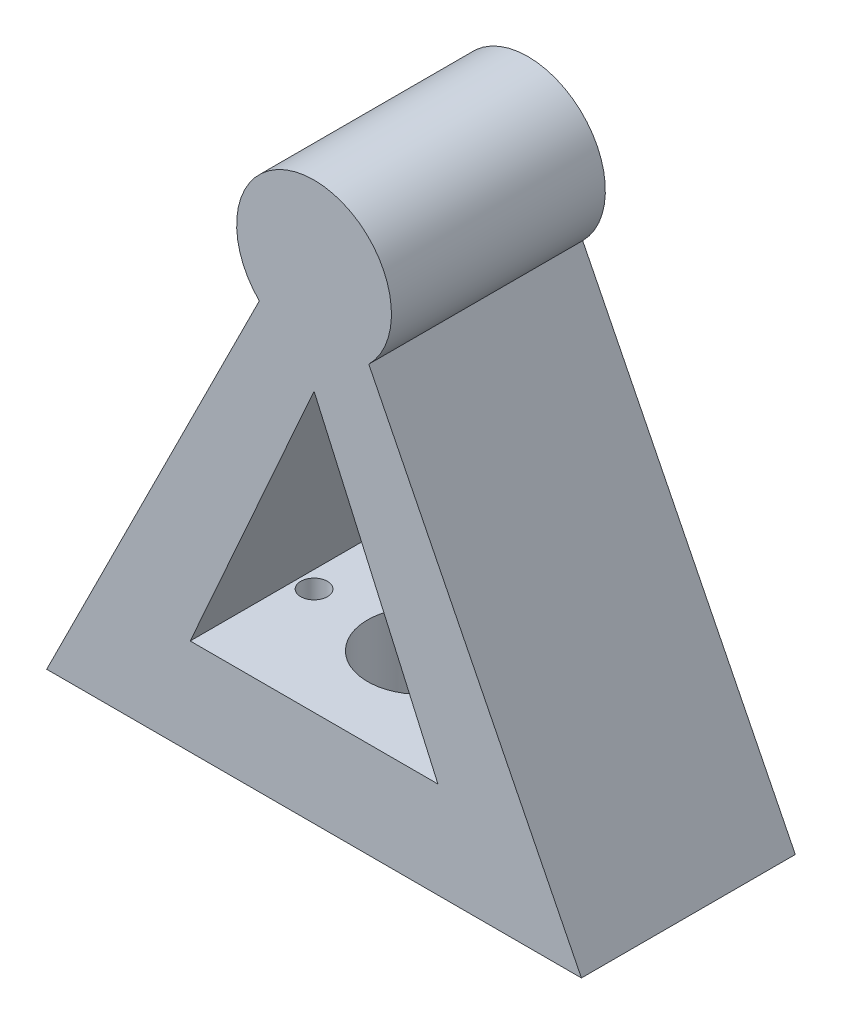
from build123d import *

# Parameters (mm, degrees)
SALIENTE_EXTRUIR1_DEPTH = 20
CROQUIS4_R              = 5
CROQUIS4_R_2            = 1.25
CORTAR_EXTRUIR3_DEPTH   = 9


with BuildPart() as part:
    # Croquis1 → Saliente-Extruir1 (new body)
    with BuildSketch(Plane.XY):
        with BuildLine():
            Line((-12.104887717, -39.764697086), (7.777460826, 0))
            ThreePointArc((7.777460826, 0), (12.895112283, 12.355103555), (18.01276374, 0))
            Line((18.01276374, 0), (37.895112283, -39.764697086))
            Line((37.895112283, -39.764697086), (-12.104887717, -39.764697086))
        make_face()
        Polygon((1.314448857, -30.764697086), (12.895112283, -4.746347114), (24.475775709, -30.764697086), (14.62955151, -30.764697086), align=None, mode=Mode.SUBTRACT)
    extrude(amount=SALIENTE_EXTRUIR1_DEPTH)

    # Croquis4 → Cortar-Extruir3 (cut)
    with BuildSketch(Plane.XZ.offset(39.764697086)):
        with Locations(Location((12.895112283, 10, 0), (0, 0, 270))):
            Circle(CROQUIS4_R)
        with Locations(Location((22.895112283, 10, 0), (0, 0, 270))):
            Circle(CROQUIS4_R_2)
        with Locations(Location((2.895112283, 10, 0), (0, 0, 270))):
            Circle(CROQUIS4_R_2)
    extrude(amount=-CORTAR_EXTRUIR3_DEPTH, mode=Mode.SUBTRACT)


solid = part.part
